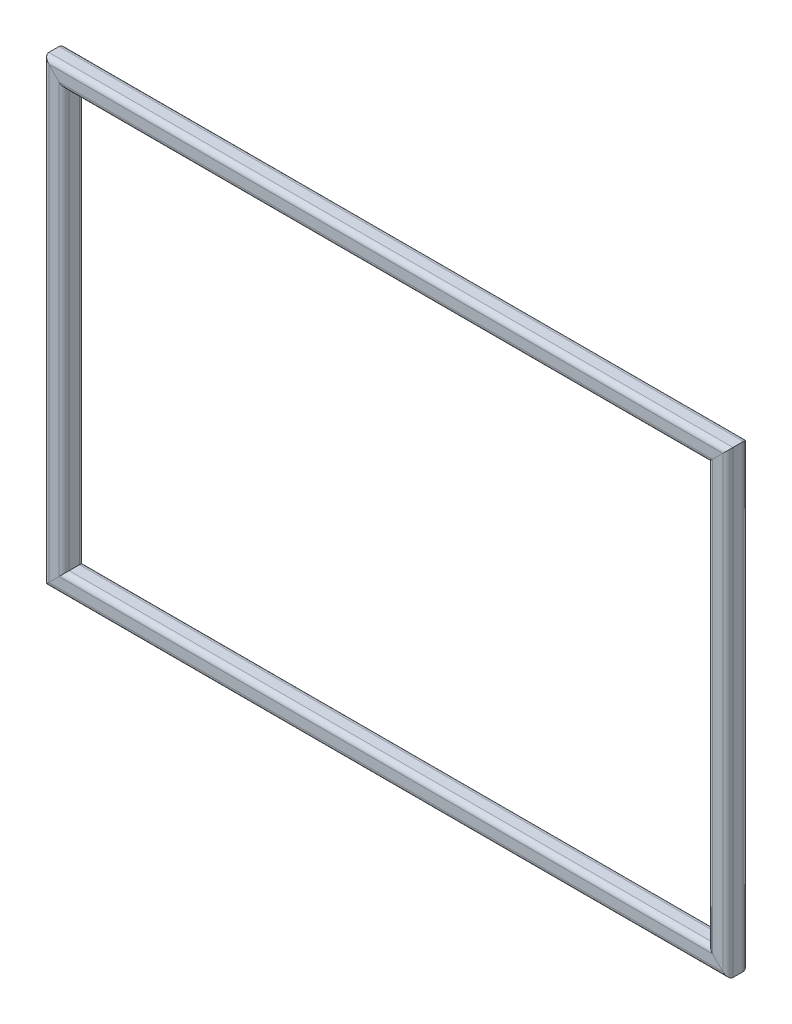
from build123d import *

# Parameters (mm, degrees)
TUBO_CUADRADO_2_X_2_X_0_25_1_DEPTH      = 556.921024484
TUBO_CUADRADO_2_X_2_X_0_25_1_DEPTH_BACK = 36.921024484
TUBO_CUADRADO_2_X_2_X_0_25_1_2_DEPTH    = 873.842048969
TUBO_CUADRADO_2_X_2_X_0_25_1_3_DEPTH    = 593.842048969
TUBO_CUADRADO_2_X_2_X_0_25_1_4_DEPTH    = 873.842048969


with BuildPart() as part:
    # Sketch1 → Tubo cuadrado 2 X 2 X 0.25(1) (new, two sides: drawn at the far end of the back side and taken through both)
    with BuildSketch(Plane(origin=(-412.7, 260, 12.7), x_dir=(1, 0, 0), z_dir=(0, -1, 0)).offset(-TUBO_CUADRADO_2_X_2_X_0_25_1_DEPTH_BACK)):
        with BuildLine():
            Line((-6.35, -12.7), (6.35, -12.7))
            ThreePointArc((6.35, -12.7), (10.840128061, -10.840128061), (12.7, -6.35))
            Line((12.7, -6.35), (12.7, 6.35))
            ThreePointArc((12.7, 6.35), (10.840128061, 10.840128061), (6.35, 12.7))
            Line((6.35, 12.7), (-6.35, 12.7))
            ThreePointArc((-6.35, 12.7), (-10.840128061, 10.840128061), (-12.7, 6.35))
            Line((-12.7, 6.35), (-12.7, -6.35))
            ThreePointArc((-12.7, -6.35), (-10.840128061, -10.840128061), (-6.35, -12.7))
        make_face()
        with BuildLine():
            Line((-6.35, -9.525), (6.35, -9.525))
            ThreePointArc((6.35, -9.525), (8.59506403, -8.59506403), (9.525, -6.35))
            Line((9.525, -6.35), (9.525, 6.35))
            ThreePointArc((9.525, 6.35), (8.59506403, 8.59506403), (6.35, 9.525))
            Line((6.35, 9.525), (-6.35, 9.525))
            ThreePointArc((-6.35, 9.525), (-8.59506403, 8.59506403), (-9.525, 6.35))
            Line((-9.525, 6.35), (-9.525, -6.35))
            ThreePointArc((-9.525, -6.35), (-8.59506403, -8.59506403), (-6.35, -9.525))
        make_face(mode=Mode.SUBTRACT)
    extrude(amount=TUBO_CUADRADO_2_X_2_X_0_25_1_DEPTH + TUBO_CUADRADO_2_X_2_X_0_25_1_DEPTH_BACK)

    # Tubo cuadrado 2 X 2 X 0.25(1) mitre 1
    split(bisect_by=Plane(origin=(-400, 260, 0), x_dir=(0.707106781, -0.707106781, 0), z_dir=(-0.707106781, -0.707106781, 0)), keep=Keep.TOP)

    # Tubo cuadrado 2 X 2 X 0.25(1) mitre 2
    split(bisect_by=Plane(origin=(-400, -260, 0), x_dir=(-0.707106781, -0.707106781, 0), z_dir=(-0.707106781, 0.707106781, 0)), keep=Keep.TOP)


with BuildPart() as body_2:
    # Sketch1 on segment 2 (carried to segment 2) → Tubo cuadrado 2 X 2 X 0.25_1 2 (new body)
    with BuildSketch(Plane(origin=(-436.921024484, -272.7, 12.7), x_dir=(0, 1, 0), z_dir=(1, 0, 0))):
        with BuildLine():
            Line((-6.35, -12.7), (6.35, -12.7))
            ThreePointArc((6.35, -12.7), (10.840128061, -10.840128061), (12.7, -6.35))
            Line((12.7, -6.35), (12.7, 6.35))
            ThreePointArc((12.7, 6.35), (10.840128061, 10.840128061), (6.35, 12.7))
            Line((6.35, 12.7), (-6.35, 12.7))
            ThreePointArc((-6.35, 12.7), (-10.840128061, 10.840128061), (-12.7, 6.35))
            Line((-12.7, 6.35), (-12.7, -6.35))
            ThreePointArc((-12.7, -6.35), (-10.840128061, -10.840128061), (-6.35, -12.7))
        make_face()
        with BuildLine():
            Line((-6.35, -9.525), (6.35, -9.525))
            ThreePointArc((6.35, -9.525), (8.59506403, -8.59506403), (9.525, -6.35))
            Line((9.525, -6.35), (9.525, 6.35))
            ThreePointArc((9.525, 6.35), (8.59506403, 8.59506403), (6.35, 9.525))
            Line((6.35, 9.525), (-6.35, 9.525))
            ThreePointArc((-6.35, 9.525), (-8.59506403, 8.59506403), (-9.525, 6.35))
            Line((-9.525, 6.35), (-9.525, -6.35))
            ThreePointArc((-9.525, -6.35), (-8.59506403, -8.59506403), (-6.35, -9.525))
        make_face(mode=Mode.SUBTRACT)
    extrude(amount=TUBO_CUADRADO_2_X_2_X_0_25_1_2_DEPTH)

    # Tubo cuadrado 2 X 2 X 0.25_1 2 mitre 1
    split(bisect_by=Plane(origin=(-400, -260, 0), x_dir=(0.707106781, 0.707106781, 0), z_dir=(0.707106781, -0.707106781, 0)), keep=Keep.TOP)

    # Tubo cuadrado 2 X 2 X 0.25_1 2 mitre 2
    split(bisect_by=Plane(origin=(400, -260, 0), x_dir=(0.707106781, -0.707106781, 0), z_dir=(-0.707106781, -0.707106781, 0)), keep=Keep.TOP)


with BuildPart() as body_3:
    # Sketch1 on segment 3 (carried to segment 3) → Tubo cuadrado 2 X 2 X 0.25_1 3 (new body)
    with BuildSketch(Plane(origin=(412.7, -296.921024484, 12.7), x_dir=(-1, 0, 0), z_dir=(0, 1, 0))):
        with BuildLine():
            Line((-6.35, -12.7), (6.35, -12.7))
            ThreePointArc((6.35, -12.7), (10.840128061, -10.840128061), (12.7, -6.35))
            Line((12.7, -6.35), (12.7, 6.35))
            ThreePointArc((12.7, 6.35), (10.840128061, 10.840128061), (6.35, 12.7))
            Line((6.35, 12.7), (-6.35, 12.7))
            ThreePointArc((-6.35, 12.7), (-10.840128061, 10.840128061), (-12.7, 6.35))
            Line((-12.7, 6.35), (-12.7, -6.35))
            ThreePointArc((-12.7, -6.35), (-10.840128061, -10.840128061), (-6.35, -12.7))
        make_face()
        with BuildLine():
            Line((-6.35, -9.525), (6.35, -9.525))
            ThreePointArc((6.35, -9.525), (8.59506403, -8.59506403), (9.525, -6.35))
            Line((9.525, -6.35), (9.525, 6.35))
            ThreePointArc((9.525, 6.35), (8.59506403, 8.59506403), (6.35, 9.525))
            Line((6.35, 9.525), (-6.35, 9.525))
            ThreePointArc((-6.35, 9.525), (-8.59506403, 8.59506403), (-9.525, 6.35))
            Line((-9.525, 6.35), (-9.525, -6.35))
            ThreePointArc((-9.525, -6.35), (-8.59506403, -8.59506403), (-6.35, -9.525))
        make_face(mode=Mode.SUBTRACT)
    extrude(amount=TUBO_CUADRADO_2_X_2_X_0_25_1_3_DEPTH)

    # Tubo cuadrado 2 X 2 X 0.25_1 3 mitre 1
    split(bisect_by=Plane(origin=(400, 260, 0), x_dir=(0.707106781, 0.707106781, 0), z_dir=(0.707106781, -0.707106781, 0)), keep=Keep.TOP)

    # Tubo cuadrado 2 X 2 X 0.25_1 3 mitre 2
    split(bisect_by=Plane(origin=(400, -260, 0), x_dir=(-0.707106781, 0.707106781, 0), z_dir=(0.707106781, 0.707106781, 0)), keep=Keep.TOP)


with BuildPart() as body_4:
    # Sketch1 on segment 4 (carried to segment 4) → Tubo cuadrado 2 X 2 X 0.25_1 4 (new body)
    with BuildSketch(Plane(origin=(436.921024484, 272.7, 12.7), x_dir=(0, -1, 0), z_dir=(-1, 0, 0))):
        with BuildLine():
            Line((-6.35, -12.7), (6.35, -12.7))
            ThreePointArc((6.35, -12.7), (10.840128061, -10.840128061), (12.7, -6.35))
            Line((12.7, -6.35), (12.7, 6.35))
            ThreePointArc((12.7, 6.35), (10.840128061, 10.840128061), (6.35, 12.7))
            Line((6.35, 12.7), (-6.35, 12.7))
            ThreePointArc((-6.35, 12.7), (-10.840128061, 10.840128061), (-12.7, 6.35))
            Line((-12.7, 6.35), (-12.7, -6.35))
            ThreePointArc((-12.7, -6.35), (-10.840128061, -10.840128061), (-6.35, -12.7))
        make_face()
        with BuildLine():
            Line((-6.35, -9.525), (6.35, -9.525))
            ThreePointArc((6.35, -9.525), (8.59506403, -8.59506403), (9.525, -6.35))
            Line((9.525, -6.35), (9.525, 6.35))
            ThreePointArc((9.525, 6.35), (8.59506403, 8.59506403), (6.35, 9.525))
            Line((6.35, 9.525), (-6.35, 9.525))
            ThreePointArc((-6.35, 9.525), (-8.59506403, 8.59506403), (-9.525, 6.35))
            Line((-9.525, 6.35), (-9.525, -6.35))
            ThreePointArc((-9.525, -6.35), (-8.59506403, -8.59506403), (-6.35, -9.525))
        make_face(mode=Mode.SUBTRACT)
    extrude(amount=TUBO_CUADRADO_2_X_2_X_0_25_1_4_DEPTH)

    # Tubo cuadrado 2 X 2 X 0.25_1 4 mitre 1
    split(bisect_by=Plane(origin=(-400, 260, 0), x_dir=(-0.707106781, 0.707106781, 0), z_dir=(0.707106781, 0.707106781, 0)), keep=Keep.TOP)

    # Tubo cuadrado 2 X 2 X 0.25_1 4 mitre 2
    split(bisect_by=Plane(origin=(400, 260, 0), x_dir=(-0.707106781, -0.707106781, 0), z_dir=(-0.707106781, 0.707106781, 0)), keep=Keep.TOP)


solid = Compound([part.part, body_2.part, body_3.part, body_4.part])
